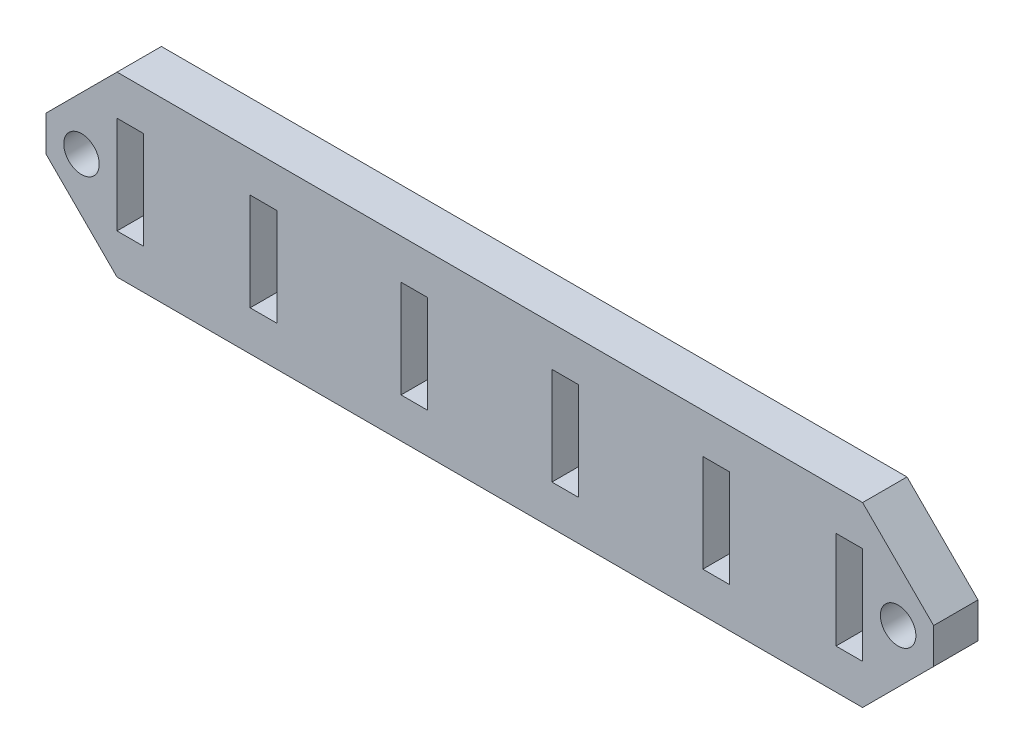
from build123d import *

# Parameters (mm, degrees)
SKETCH1_W           = 100
SKETCH1_H           = 20
BOSS_EXTRUDE1_DEPTH = 5
SKETCH2_R           = 2
SKETCH2_W           = 3
SKETCH2_H           = 11
CUT_EXTRUDE1_DEPTH  = 5
CUT_EXTRUDE2_DEPTH  = 5


with BuildPart() as part:
    # Sketch1 → Boss-Extrude1 (new body)
    with BuildSketch(Plane.XY):
        with Locations((50, 10)):
            Rectangle(SKETCH1_W, SKETCH1_H)
    extrude(amount=BOSS_EXTRUDE1_DEPTH)

    # Sketch2 → Cut-Extrude1 (cut)
    with BuildSketch(Plane(origin=(0, 0, 0), x_dir=(-1, 0, 0), z_dir=(0, 0, -1))):
        with Locations((-96, 10)):
            Circle(SKETCH2_R)
        with Locations((-4, 10)):
            Circle(SKETCH2_R)
        with Locations((-90.5, 10)):
            Rectangle(SKETCH2_W, SKETCH2_H)
        with Locations((-75.5, 10)):
            Rectangle(SKETCH2_W, SKETCH2_H)
        with Locations((-58.5, 10)):
            Rectangle(SKETCH2_W, SKETCH2_H)
        with Locations((-41.5, 10)):
            Rectangle(SKETCH2_W, SKETCH2_H)
        with Locations((-24.5, 10)):
            Rectangle(SKETCH2_W, SKETCH2_H)
        with Locations((-9.5, 10)):
            Rectangle(SKETCH2_W, SKETCH2_H)
    extrude(amount=-CUT_EXTRUDE1_DEPTH, mode=Mode.SUBTRACT)

    # Sketch3 → Cut-Extrude2 (cut)
    with BuildSketch(Plane(origin=(0, 0, 0), x_dir=(-1, 0, 0), z_dir=(0, 0, -1))):
        Polygon((-92, 20), (-100, 12), (-100, 20), align=None)
        Polygon((-100, 8), (-100, 0), (-92, 0), align=None)
        Polygon((-8, 20), (0, 20), (0, 12), align=None)
        Polygon((0, 8), (-8, 0), (0, 0), align=None)
    extrude(amount=-CUT_EXTRUDE2_DEPTH, mode=Mode.SUBTRACT)


solid = part.part
